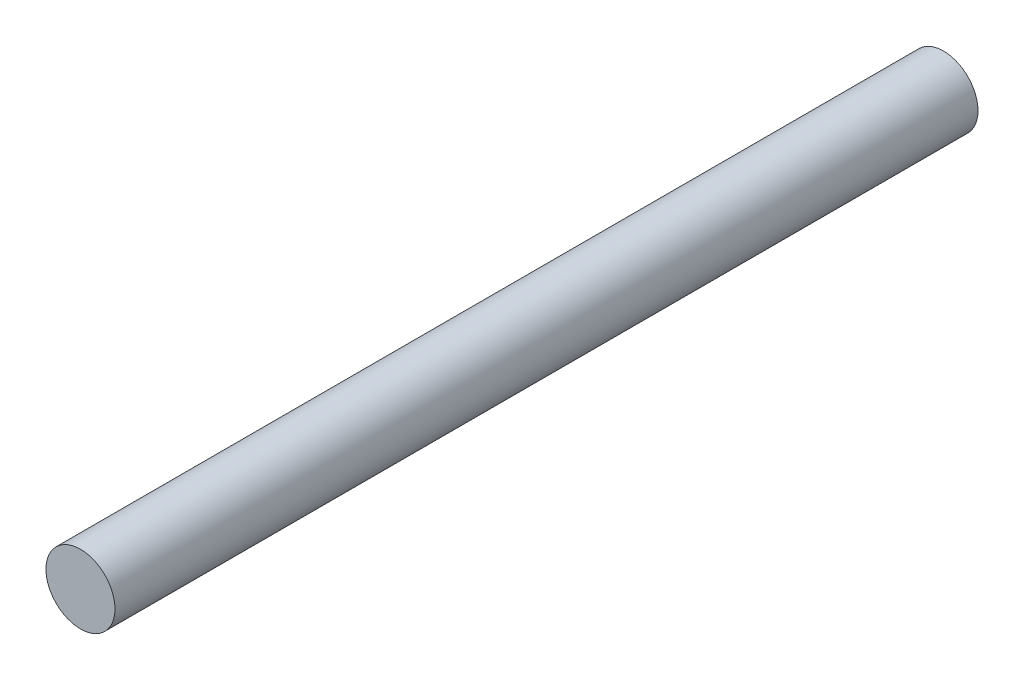
from build123d import *

# Parameters (mm, degrees)
CROQUIS1_R              = 4
SALIENTE_EXTRUIR1_DEPTH = 100


with BuildPart() as part:
    # Croquis1 → Saliente-Extruir1 (new body)
    with BuildSketch(Plane.XY):
        Circle(CROQUIS1_R)
    extrude(amount=SALIENTE_EXTRUIR1_DEPTH)


solid = part.part
